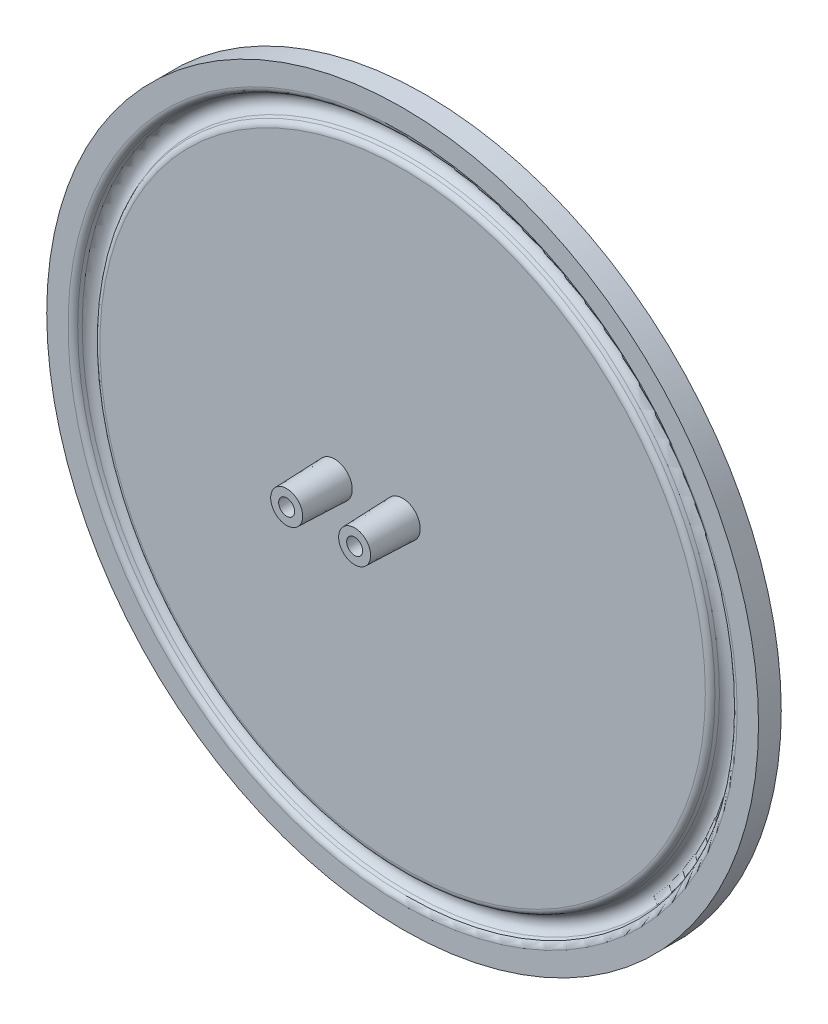
from build123d import *

# Parameters (mm, degrees)
SKETCH2_R          = 2.2
SKETCH3_R          = 2
SKETCH2_5_R        = 2.2
SKETCH3_5_R        = 2
SKETCH2_6_R        = 2.2
SKETCH3_6_R        = 2
SHELL2_T           = -1
SHELL3_T           = -1
SHELL4_T           = -1
CUT_EXTRUDE2_START = -9.9248
SKETCH4_R          = 1.166111265
CUT_EXTRUDE2_DEPTH = 9.9248


with BuildPart() as part:
    # Sketch1 → Revolve1 (revolve)
    with BuildSketch(Plane(origin=(0, 0, 0), x_dir=(0, 0, -1), z_dir=(1, 0, 0)), mode=Mode.PRIVATE) as revolve1_sk:
        with BuildLine():
            Line((0, 0), (0, 37.848527725))
            ThreePointArc((0, 37.848527725), (0.130798304, 38.283122907), (0.479738309, 38.573333247))
            Line((0.479738309, 38.573333247), (0.872854821, 38.740201306))
            ThreePointArc((0.872854821, 38.740201306), (1.6002, 39.8391), (0.872854821, 40.937998694))
            Line((0.872854821, 40.937998694), (0.479738309, 41.104866753))
            ThreePointArc((0.479738309, 41.104866753), (0.130798304, 41.395077093), (0, 41.829672275))
            Line((0, 41.829672275), (0, 44.5))
            Line((0, 44.5), (2.8448, 44.5))
            Line((2.8448, 44.5), (7.9248, 37.245008126))
            Line((7.9248, 37.245008126), (7.9248, 0))
            Line((7.9248, 0), (0, 0))
        make_face()
    revolve(revolve1_sk.sketch.rotate(Axis((0, 0, 0), (0, 0, -1)), 90), axis=Axis((0, 0, 0), (0, 0, -1)))


with BuildPart() as body_2:
    # Sketch2 → Loft1 section 0
    with BuildSketch(Plane(origin=(0, 0, -7.9248), x_dir=(-1, 0, 0), z_dir=(0, 0, -1))):
        with Locations((-8.5, 0)):
            Circle(SKETCH2_R)
    # Sketch3 → Loft1 section 1
    with BuildSketch(Plane(origin=(0, 0, -13.9248), x_dir=(-1, 0, 0), z_dir=(0, 0, -1))):
        with Locations((-8.5, 0)):
            Circle(SKETCH3_R)
    loft()

    # Shell2
    shell2_openings = [body_2.faces().sort_by_distance(p)[0] for p in [
        (8.5, 0, -13.9248),
    ]]
    offset(amount=SHELL2_T, openings=shell2_openings, kind=Kind.INTERSECTION)


with BuildPart() as body_3:
    # Sketch2<5> → Loft2 section 0
    with BuildSketch(Plane(origin=(0, 0, -7.9248), x_dir=(-1, 0, 0), z_dir=(0, 0, -1))):
        Circle(SKETCH2_5_R)
    # Sketch3<5> → Loft2 section 1
    with BuildSketch(Plane(origin=(0, 0, -13.9248), x_dir=(-1, 0, 0), z_dir=(0, 0, -1))):
        Circle(SKETCH3_5_R)
    loft()

    # Shell3
    shell3_openings = [body_3.faces().sort_by_distance(p)[0] for p in [
        (0, 0, -13.9248),
    ]]
    offset(amount=SHELL3_T, openings=shell3_openings, kind=Kind.INTERSECTION)


with BuildPart() as body_4:
    # Sketch2<6> → Loft3 section 0
    with BuildSketch(Plane(origin=(0, 0, -7.9248), x_dir=(-1, 0, 0), z_dir=(0, 0, -1))):
        with Locations((8.5, 0)):
            Circle(SKETCH2_6_R)
    # Sketch3<6> → Loft3 section 1
    with BuildSketch(Plane(origin=(0, 0, -13.9248), x_dir=(-1, 0, 0), z_dir=(0, 0, -1))):
        with Locations((8.5, 0)):
            Circle(SKETCH3_6_R)
    loft()

    # Shell4
    shell4_openings = [body_4.faces().sort_by_distance(p)[0] for p in [
        (-8.5, 0, -13.9248),
    ]]
    offset(amount=SHELL4_T, openings=shell4_openings, kind=Kind.INTERSECTION)


with BuildPart() as body_5:
    # Mirror4: mirrored copy
    add(body_3.part.mirror(Plane(origin=(0, 0, -3.9624), x_dir=(1, 0, 0), z_dir=(0, 0, -1))))


with BuildPart() as body_6:
    # Mirror4 2: mirrored copy
    add(body_4.part.mirror(Plane(origin=(0, 0, -3.9624), x_dir=(1, 0, 0), z_dir=(0, 0, -1))))


with BuildPart() as cut_extrude2_tool:
    # Sketch4 → Cut-Extrude2 (new body)
    with BuildSketch(Plane(origin=(0, 0, -8.9248), x_dir=(-1, 0, 0), z_dir=(0, 0, -1)).offset(CUT_EXTRUDE2_START)):
        with Locations(Location((0, 0, 0), (0, 0, 180))):
            Circle(SKETCH4_R)
        with Locations(Location((8.5, 0, 0), (0, 0, 180))):
            Circle(SKETCH4_R)
    extrude(amount=CUT_EXTRUDE2_DEPTH)


with BuildPart() as part_1:
    add(part.part)

    # Cut-Extrude2: cut by cut_extrude2_tool
    add(cut_extrude2_tool.part, mode=Mode.SUBTRACT)


with BuildPart() as body_3_1:
    add(body_3.part)

    # Cut-Extrude2: cut by cut_extrude2_tool
    add(cut_extrude2_tool.part, mode=Mode.SUBTRACT)


with BuildPart() as body_4_1:
    add(body_4.part)

    # Cut-Extrude2: cut by cut_extrude2_tool
    add(cut_extrude2_tool.part, mode=Mode.SUBTRACT)


with BuildPart() as body_5_1:
    add(body_5.part)

    # Cut-Extrude2: cut by cut_extrude2_tool
    add(cut_extrude2_tool.part, mode=Mode.SUBTRACT)


with BuildPart() as body_6_1:
    add(body_6.part)

    # Cut-Extrude2: cut by cut_extrude2_tool
    add(cut_extrude2_tool.part, mode=Mode.SUBTRACT)


solid = Compound([body_2.part, part_1.part, body_3_1.part, body_4_1.part, body_5_1.part, body_6_1.part])
